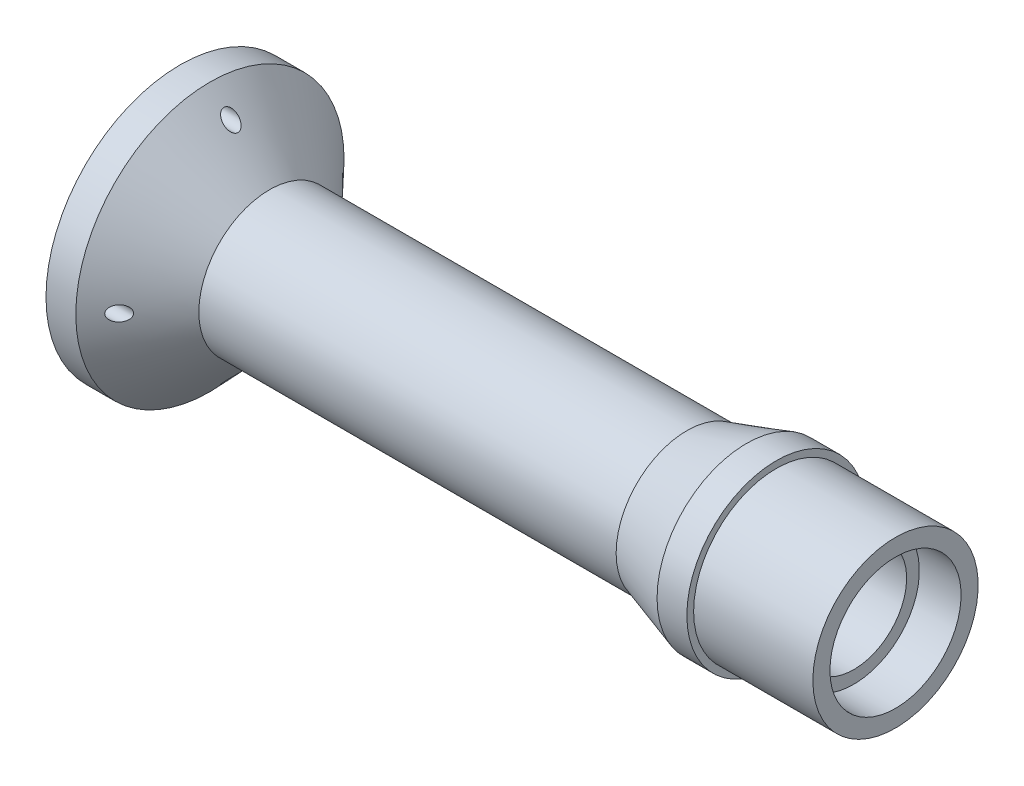
from build123d import *

# Parameters (mm, degrees)
IZIM2_R                 = 1.25
KES_EKSTR_ZYON1_DEPTH   = 16
DAIRESEL_KAPLAMA1_COUNT = 4


with BuildPart() as part:
    # Çizim1 → Döndür1 (revolve)
    with BuildSketch(Plane.XY, mode=Mode.PRIVATE) as d_nd_r1_sk:
        Polygon((-14.08429038, 22.5), (-14.08429038, 8.864027545), (98.91570962, 8.864027545), (98.91570962, 11), (105.91570962, 11), (105.91570962, 13.864027545), (85.91570962, 13.864027545), (85.91570962, 15), (80.91570962, 15), (70.91570962, 11.864027545), (0.91570962, 11.864027545), (-9.08429038, 22.5), align=None)
    revolve(d_nd_r1_sk.sketch.rotate(Axis((0, 0, 0), (1, 0, 0)), 90), axis=Axis((0, 0, 0), (1, 0, 0)))

    # Çizim2 → Kes-Ekstrüzyon1 (cut)
    with BuildSketch(Plane.ZY.offset(14.08429038)):
        with Locations((0, 18.75)):
            Circle(IZIM2_R)
    kes_ekstr_zyon1 = extrude(amount=-KES_EKSTR_ZYON1_DEPTH, mode=Mode.SUBTRACT)

    # Dairesel Kaplama1: Kes-Ekstrüzyon1 ×4 about axis
    dairesel_kaplama1_axis = Axis((0, 0, 0), (1, 0, 0))
    for i in range(1, DAIRESEL_KAPLAMA1_COUNT):
        add(kes_ekstr_zyon1.rotate(dairesel_kaplama1_axis, i * 360 / DAIRESEL_KAPLAMA1_COUNT), mode=Mode.SUBTRACT)


solid = part.part
